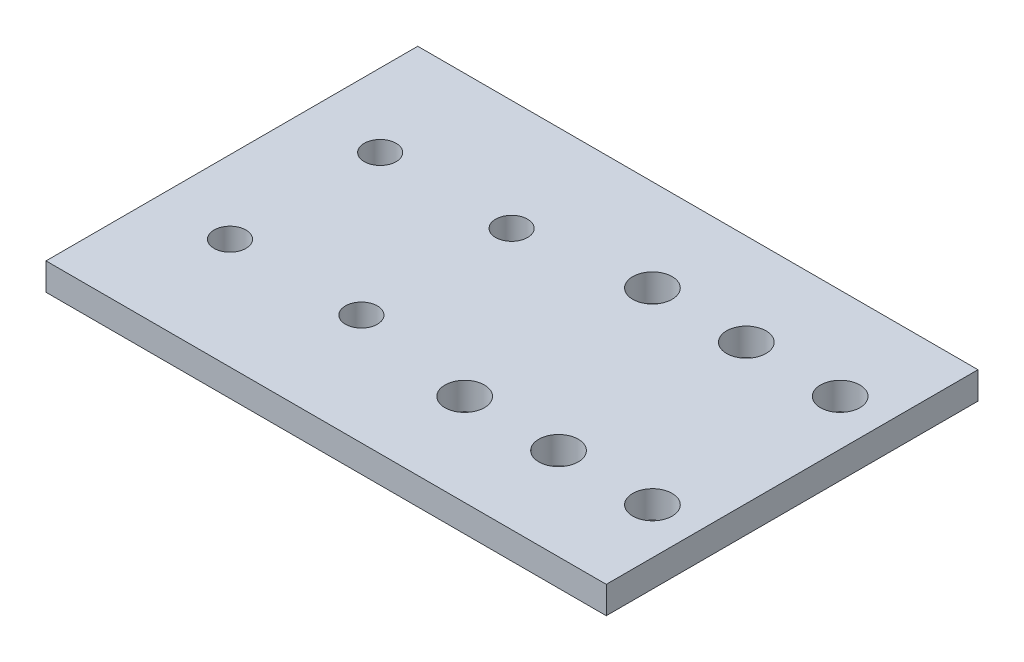
from build123d import *

# Parameters (mm, degrees)
SKETCH_1_R          = 1.7
SKETCH_1_W          = 5
SKETCH_1_H          = 13
SKETCH_1_H_2        = 2
EXTRUDE_3_DEPTH     = 2.9
SKETCH_3_R          = 2.1
CUT_EXTRUDE_3_DEPTH = 2.9
SKETCH_4_W          = 20
SKETCH_4_H          = 40
SKETCH_4_R          = 2.1
EXTRUDE_4_DEPTH     = 2.9
SKETCH_5_W          = 70
SKETCH_5_H          = 40
SKETCH_5_W_2        = 69.6
SKETCH_5_H_2        = 39.6
CUT_EXTRUDE_4_DEPTH = 2.9
SKETCH_6_W          = 9.917430794
SKETCH_6_H          = 39.6
SKETCH_6_R          = 2.1
CUT_EXTRUDE_5_DEPTH = 10


with BuildPart() as part:
    # 草图1 → 凸台-拉伸3 (new body)
    # profile 1 of 10: a face of its own
    with BuildSketch(Plane(origin=(0, 0, 0), x_dir=(1, 0, 0), z_dir=(0, 1, 0))):
        with BuildLine():
            Line((-40, 113), (-70, 113))
            Line((-70, 113), (-70, 108))
            Line((-70, 108), (-70, 92))
            Line((-70, 92), (-63.7, 92))
            ThreePointArc((-63.7, 92), (-62, 93.7), (-60.3, 92))
            ThreePointArc((-60.3, 92), (-60.797918472, 90.797918472), (-62, 90.3))
            Line((-62, 90.3), (-62, 87))
            Line((-62, 87), (-48, 87))
            Line((-48, 87), (-48, 90.3))
            ThreePointArc((-48, 90.3), (-49.202081528, 93.202081528), (-46.3, 92))
            Line((-46.3, 92), (-40, 92))
            Line((-40, 92), (-40, 113))
        make_face()
        with Locations(Location((-62, 108, 0), (0, 0, 270))):
            Circle(SKETCH_1_R, mode=Mode.SUBTRACT)
        with Locations(Location((-48, 108, 0), (0, 0, 270))):
            Circle(SKETCH_1_R, mode=Mode.SUBTRACT)
    # profile 2 of 10: a face of its own
    with BuildSketch(Plane(origin=(0, 0, 0), x_dir=(1, 0, 0), z_dir=(0, 1, 0))):
        with BuildLine():
            Line((-70, 92), (-70, 87))
            Line((-70, 87), (-62, 87))
            Line((-62, 87), (-62, 90.3))
            ThreePointArc((-62, 90.3), (-63.202081528, 90.797918472), (-63.7, 92))
            Line((-63.7, 92), (-70, 92))
        make_face()
    # profile 3 of 10: a face of its own
    with BuildSketch(Plane(origin=(0, 0, 0), x_dir=(1, 0, 0), z_dir=(0, 1, 0))):
        with BuildLine():
            Line((-48, 90.3), (-48, 87))
            Line((-48, 87), (-40, 87))
            Line((-40, 87), (-40, 92))
            Line((-40, 92), (-46.3, 92))
            ThreePointArc((-46.3, 92), (-46.797918472, 90.797918472), (-48, 90.3))
        make_face()
    # profile 4 of 10: a face of its own
    with BuildSketch(Plane(origin=(0, 0, 0), x_dir=(1, 0, 0), z_dir=(0, 1, 0))):
        Polygon((-70, 87), (-70, 80), (-20, 80), (-20, 85), (-25, 85), (-25, 87), (-40, 87), (-48, 87), (-62, 87), align=None)
    # profile 5 of 10: a face of its own
    with BuildSketch(Plane(origin=(0, 0, 0), x_dir=(1, 0, 0), z_dir=(0, 1, 0))):
        Polygon((-25, 113), (-40, 113), (-40, 92), (-40, 87), (-25, 87), (-25, 100), align=None)
    # profile 6 of 10: a face of its own
    with BuildSketch(Plane(origin=(0, 0, 0), x_dir=(1, 0, 0), z_dir=(0, 1, 0))):
        with Locations((-22.5, 93.5)):
            Rectangle(SKETCH_1_W, SKETCH_1_H)
    # profile 7 of 10: a face of its own
    with BuildSketch(Plane(origin=(0, 0, 0), x_dir=(1, 0, 0), z_dir=(0, 1, 0))):
        with Locations((-22.5, 106.5)):
            Rectangle(SKETCH_1_W, SKETCH_1_H)
    # profile 8 of 10: a face of its own
    with BuildSketch(Plane(origin=(0, 0, 0), x_dir=(1, 0, 0), z_dir=(0, 1, 0))):
        with Locations((-22.5, 86)):
            Rectangle(SKETCH_1_W, SKETCH_1_H_2)
    # profile 9 of 10: a face of its own
    with BuildSketch(Plane(origin=(0, 0, 0), x_dir=(1, 0, 0), z_dir=(0, 1, 0))):
        Polygon((-20, 120), (-70, 120), (-70, 113), (-40, 113), (-25, 113), (-25, 115), (-20, 115), align=None)
    # profile 10 of 10: a face of its own
    with BuildSketch(Plane(origin=(0, 0, 0), x_dir=(1, 0, 0), z_dir=(0, 1, 0))):
        with Locations((-22.5, 114)):
            Rectangle(SKETCH_1_W, SKETCH_1_H_2)
    extrude(amount=EXTRUDE_3_DEPTH)

    # 草图3 → 切除-拉伸3 (cut)
    with BuildSketch(Plane(origin=(0, 2.9, 0), x_dir=(1, 0, 0), z_dir=(0, 1, 0))):
        with Locations(Location((-25, 110, 0), (0, 0, 270))):
            Circle(SKETCH_3_R)
        with Locations(Location((-25, 90, 0), (0, 0, 270))):
            Circle(SKETCH_3_R)
        with Locations(Location((-35, 90, 0), (0, 0, 270))):
            Circle(SKETCH_3_R)
        with Locations(Location((-35, 110, 0), (0, 0, 270))):
            Circle(SKETCH_3_R)
    extrude(amount=-CUT_EXTRUDE_3_DEPTH, mode=Mode.SUBTRACT)

    # 草图4 → 凸台-拉伸4 (add)
    with BuildSketch(Plane(origin=(0, 2.9, 0), x_dir=(1, 0, 0), z_dir=(0, 1, 0))):
        with Locations((-10, 100)):
            Rectangle(SKETCH_4_W, SKETCH_4_H)
        with Locations(Location((-15, 110, 0), (0, 0, 270))):
            Circle(SKETCH_4_R, mode=Mode.SUBTRACT)
        with Locations(Location((-15, 90, 0), (0, 0, 270))):
            Circle(SKETCH_4_R, mode=Mode.SUBTRACT)
        with Locations(Location((-5, 110, 0), (0, 0, 270))):
            Circle(SKETCH_4_R, mode=Mode.SUBTRACT)
        with Locations(Location((-5, 90, 0), (0, 0, 270))):
            Circle(SKETCH_4_R, mode=Mode.SUBTRACT)
    extrude(amount=-EXTRUDE_4_DEPTH)

    # 草图5 → 切除-拉伸4 (cut)
    with BuildSketch(Plane(origin=(0, 2.9, 0), x_dir=(1, 0, 0), z_dir=(0, 1, 0))):
        with Locations((-35, 100)):
            Rectangle(SKETCH_5_W, SKETCH_5_H)
        with Locations((-35, 100)):
            Rectangle(SKETCH_5_W_2, SKETCH_5_H_2, mode=Mode.SUBTRACT)
    extrude(amount=-CUT_EXTRUDE_4_DEPTH, mode=Mode.SUBTRACT)

    # 草图6 → 切除-拉伸5 (cut)
    with BuildSketch(Plane(origin=(0, 2.9, 0), x_dir=(1, 0, 0), z_dir=(0, 1, 0))):
        with Locations((-5.158715397, 100)):
            Rectangle(SKETCH_6_W, SKETCH_6_H)
        with Locations((-5, 90)):
            Circle(SKETCH_6_R, mode=Mode.SUBTRACT)
        with Locations((-5, 110)):
            Circle(SKETCH_6_R, mode=Mode.SUBTRACT)
    extrude(amount=-CUT_EXTRUDE_5_DEPTH, mode=Mode.SUBTRACT)


solid = part.part
